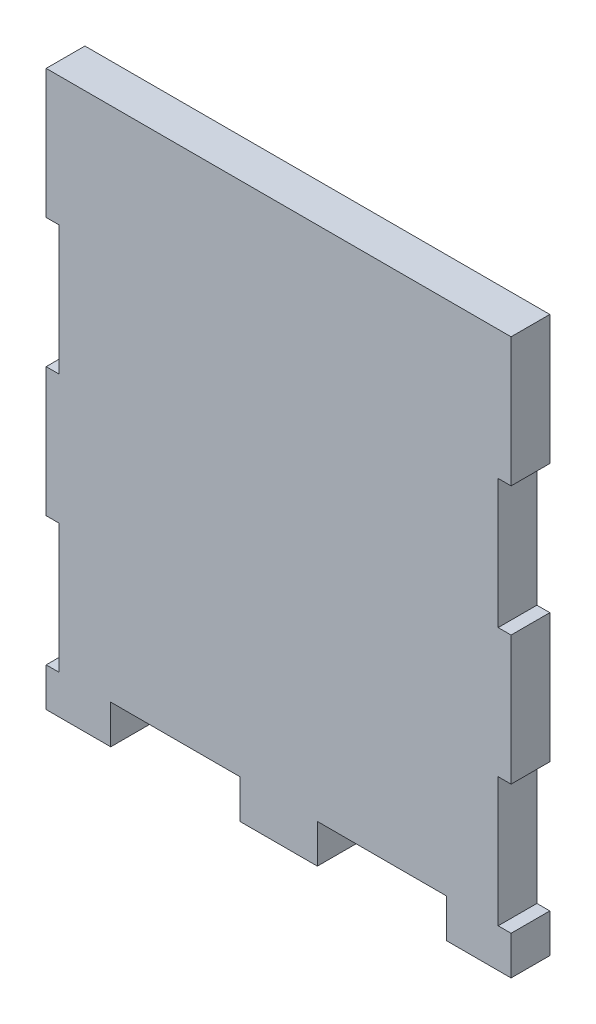
from build123d import *

# Parameters (mm, degrees)
SKETCH1_W           = 1
SKETCH1_H           = 10
BOSS_EXTRUDE1_DEPTH = 3


with BuildPart() as part:
    # Sketch1 → Boss-Extrude1 (new body)
    with BuildSketch(Plane.XY):
        Polygon((1, 10), (1, 0), (5, 0), (15, 0), (18, 0), (18, 40), (1, 40), (1, 30), (1, 20), align=None)
        Polygon((18, 40), (18, 0), (21, 0), (31, 0), (35, 0), (35, 10), (35, 20), (35, 30), (35, 40), align=None)
        with Locations((35.5, 35)):
            Rectangle(SKETCH1_W, SKETCH1_H)
        with Locations((0.5, 35)):
            Rectangle(SKETCH1_W, SKETCH1_H)
        with Locations((0.5, 15)):
            Rectangle(SKETCH1_W, SKETCH1_H)
        with Locations((35.5, 15)):
            Rectangle(SKETCH1_W, SKETCH1_H)
        Polygon((1, 0), (0, 0), (0, -3), (5, -3), (5, 0), align=None)
        Polygon((18, 0), (15, 0), (15, -3), (21, -3), (21, 0), align=None)
        Polygon((31, 0), (31, -3), (36, -3), (36, 0), (35, 0), align=None)
    extrude(amount=BOSS_EXTRUDE1_DEPTH)


solid = part.part
